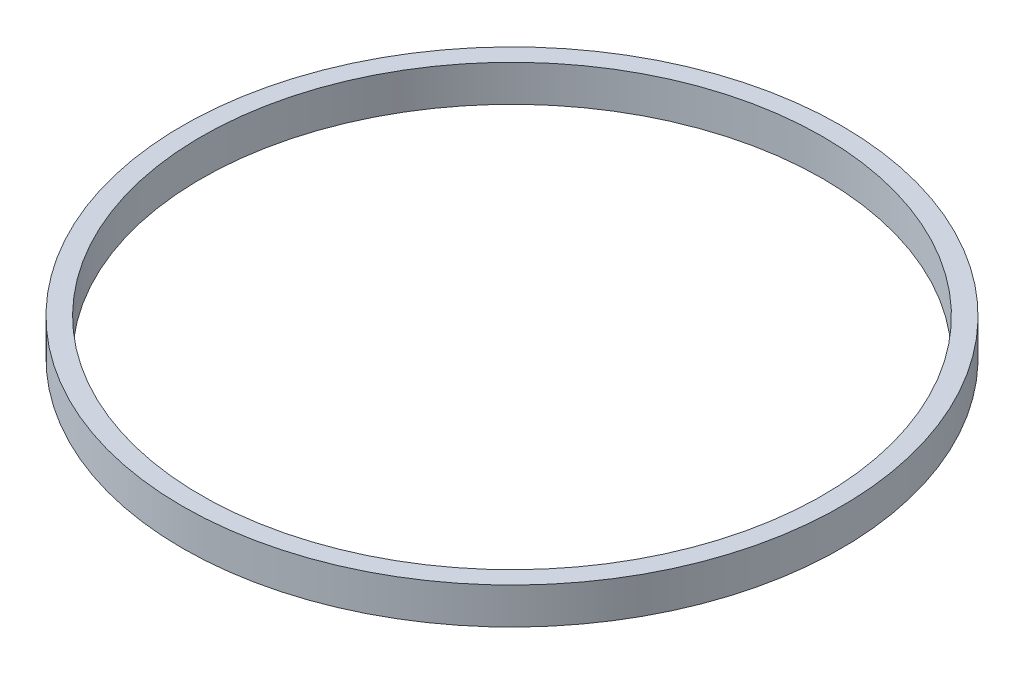
from build123d import *

# Parameters (mm, degrees)
SKETCH1_W = 1.3462
SKETCH1_H = 2.6035


with BuildPart() as part:
    # Sketch1 → Revolve1 (revolve)
    with BuildSketch(Plane.XY, mode=Mode.PRIVATE) as revolve1_sk:
        with Locations((-22.8981, 1.30175)):
            Rectangle(SKETCH1_W, SKETCH1_H)
    revolve(revolve1_sk.sketch.rotate(Axis((0, 0, 0), (0, 1, 0)), 270), axis=Axis((0, 0, 0), (0, 1, 0)))


solid = part.part
